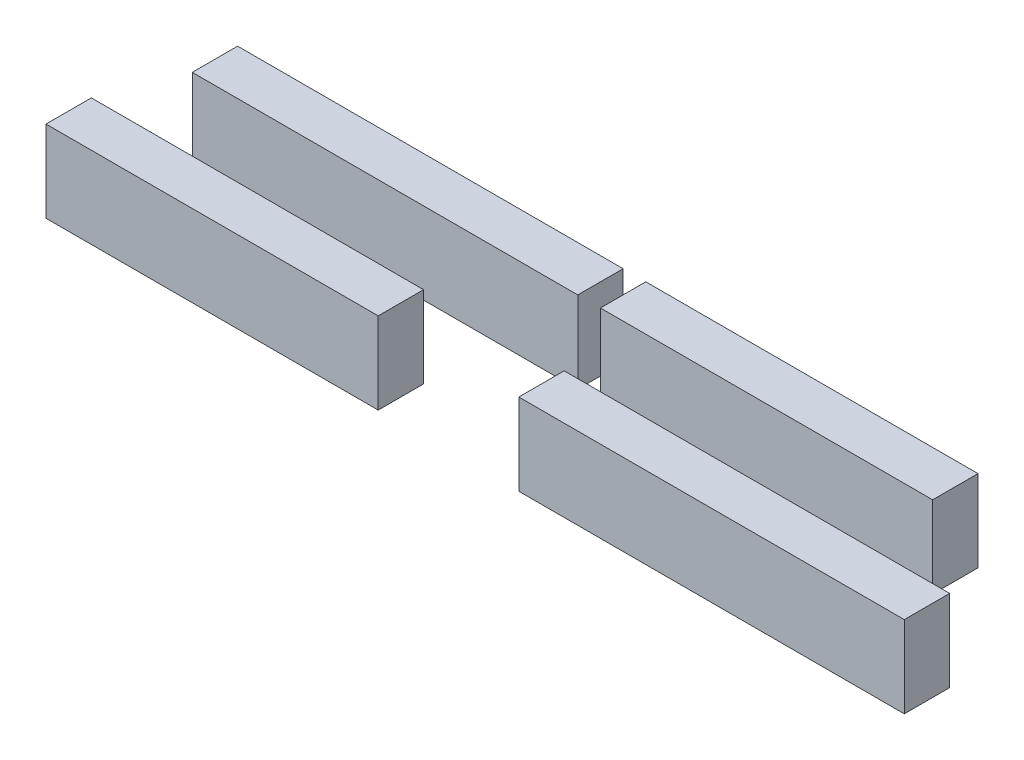
from build123d import *

# Parameters (mm, degrees)
SKETCH1_W             = 42.5
SKETCH1_H             = 5
BOSS_EXTRUDE1_DEPTH   = 9
SKETCH1_W_2           = 36.625
BOSS_EXTRUDE1_2_DEPTH = 9
BOSS_EXTRUDE1_3_DEPTH = 9
BOSS_EXTRUDE1_4_DEPTH = 9


with BuildPart() as part:
    # Sketch1 → Boss-Extrude1 (new body)
    with BuildSketch(Plane(origin=(0, 0, 0), x_dir=(1, 0, 0), z_dir=(0, 1, 0))):
        with Locations((76, 7)):
            Rectangle(SKETCH1_W, SKETCH1_H)
    extrude(amount=BOSS_EXTRUDE1_DEPTH)


with BuildPart() as body_2:
    # Sketch1 → Boss-Extrude1 2 (new body)
    with BuildSketch(Plane(origin=(0, 0, 0), x_dir=(1, 0, 0), z_dir=(0, 1, 0))):
        with Locations((20.9375, 7)):
            Rectangle(SKETCH1_W_2, SKETCH1_H)
    extrude(amount=BOSS_EXTRUDE1_2_DEPTH)


with BuildPart() as body_3:
    # Sketch1 → Boss-Extrude1 3 (new body)
    with BuildSketch(Plane(origin=(0, 0, 0), x_dir=(1, 0, 0), z_dir=(0, 1, 0))):
        with Locations((69.0625, 20)):
            Rectangle(SKETCH1_W_2, SKETCH1_H)
    extrude(amount=BOSS_EXTRUDE1_3_DEPTH)


with BuildPart() as body_4:
    # Sketch1 → Boss-Extrude1 4 (new body)
    with BuildSketch(Plane(origin=(0, 0, 0), x_dir=(1, 0, 0), z_dir=(0, 1, 0))):
        with Locations((27, 20)):
            Rectangle(SKETCH1_W, SKETCH1_H)
    extrude(amount=BOSS_EXTRUDE1_4_DEPTH)


solid = Compound([part.part, body_2.part, body_3.part, body_4.part])
